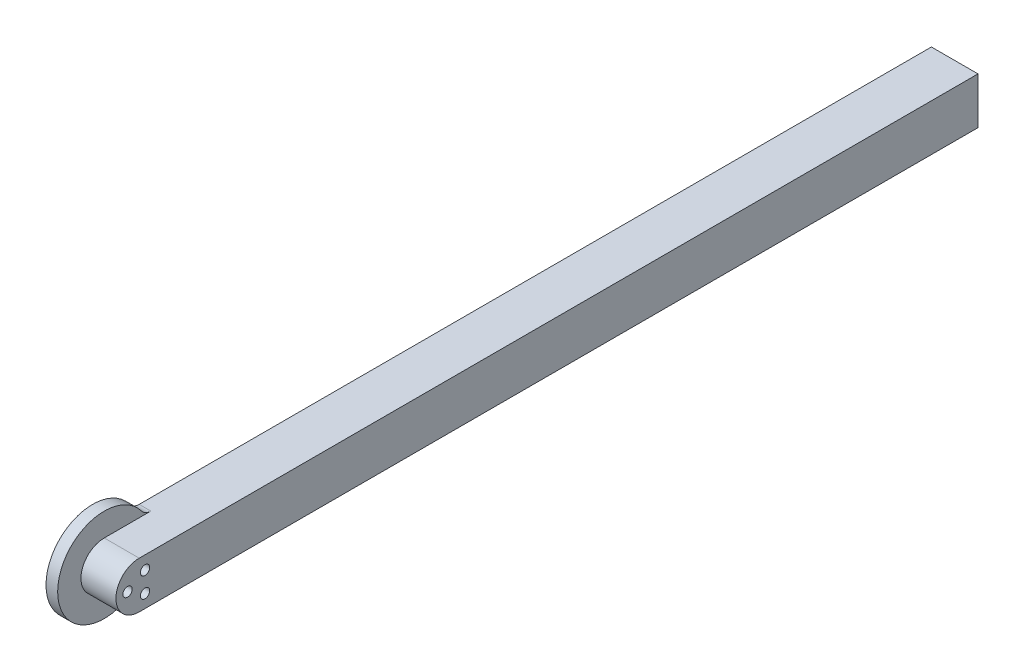
from build123d import *

# Parameters (mm, degrees)
SKETCH1_R           = 2.5527
BOSS_EXTRUDE1_DEPTH = 12.7
SKETCH3_R           = 25.4
BOSS_EXTRUDE2_DEPTH = 6.35
SKETCH4_R           = 2.5527
CUT_EXTRUDE1_DEPTH  = 459.301104624
FILLET1_R           = 6.35


with BuildPart() as part:
    # Sketch1 → Boss-Extrude1 (new, symmetric)
    with BuildSketch(Plane(origin=(0, 0, 0), x_dir=(0, 0, -1), z_dir=(1, 0, 0))):
        with BuildLine():
            Line((0, 12.7), (457.2, 12.7))
            Line((457.2, 12.7), (457.2, -12.7))
            Line((457.2, -12.7), (0, -12.7))
            ThreePointArc((0, -12.7), (-12.7, 0), (0, 12.7))
        make_face()
        with Locations((3.175, 5.499261314)):
            Circle(SKETCH1_R, mode=Mode.SUBTRACT)
        with Locations((-6.35, 0)):
            Circle(SKETCH1_R, mode=Mode.SUBTRACT)
        with Locations((3.175, -5.499261314)):
            Circle(SKETCH1_R, mode=Mode.SUBTRACT)
    extrude(amount=BOSS_EXTRUDE1_DEPTH, both=True)

    # Sketch3 → Boss-Extrude2 (add)
    with BuildSketch(Plane.ZY.offset(12.7)):
        Circle(SKETCH3_R)
    extrude(amount=-BOSS_EXTRUDE2_DEPTH)

    # Sketch4 → Cut-Extrude1 (cut, through all)
    with BuildSketch(Plane(origin=(-6.35, 0, 0), x_dir=(0, 0, -1), z_dir=(1, 0, 0))):
        with Locations((3.175, 5.499261314)):
            Circle(SKETCH4_R)
        with Locations((3.175, -5.499261314)):
            Circle(SKETCH4_R)
        with Locations((-6.35, 0)):
            Circle(SKETCH4_R)
    extrude(amount=-CUT_EXTRUDE1_DEPTH, mode=Mode.SUBTRACT)

    # Fillet1
    fillet1_edges = [part.edges().sort_by_distance(p)[0] for p in [
        (-9.525, 12.7, -21.997045256),
        (-9.525, -12.7, -21.997045256),
    ]]
    fillet(fillet1_edges, radius=FILLET1_R)


solid = part.part
